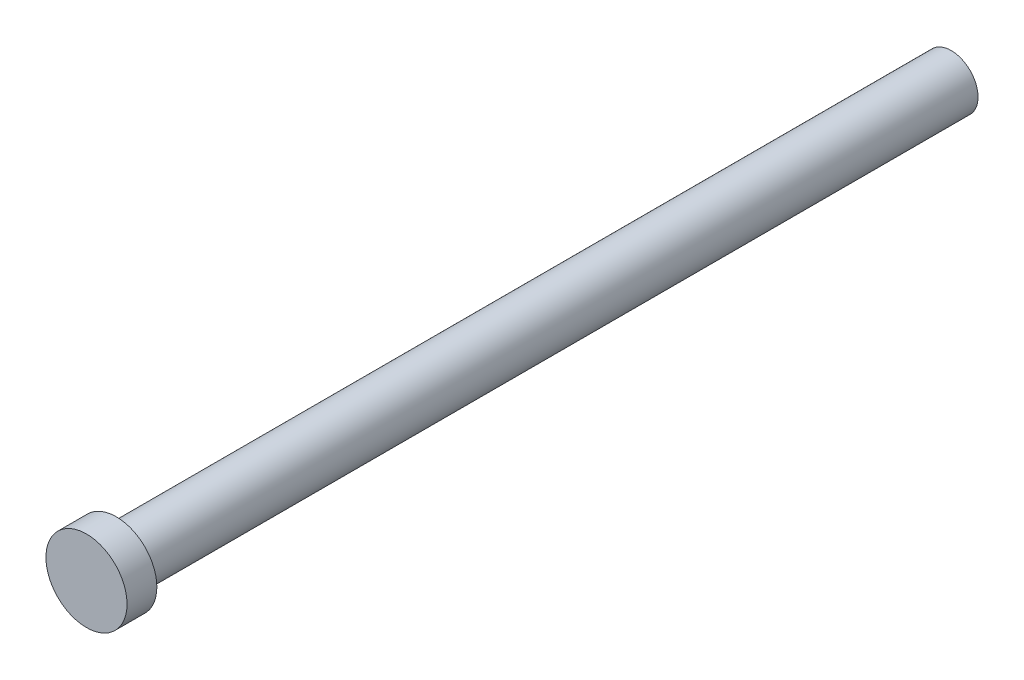
from build123d import *

# Parameters (mm, degrees)
ESQUISSE1_R        = 1.7
BOSS_EXTRU_1_DEPTH = 1.25
ESQUISSE2_R        = 1.125
BOSS_EXTRU_2_DEPTH = 35


with BuildPart() as part:
    # Esquisse1 → Boss.-Extru.1 (new body)
    with BuildSketch(Plane.XY):
        Circle(ESQUISSE1_R)
    extrude(amount=BOSS_EXTRU_1_DEPTH)

    # Esquisse2 → Boss.-Extru.2 (add)
    with BuildSketch(Plane(origin=(0, 0, 0), x_dir=(-1, 0, 0), z_dir=(0, 0, -1))):
        Circle(ESQUISSE2_R)
    extrude(amount=BOSS_EXTRU_2_DEPTH)


solid = part.part
